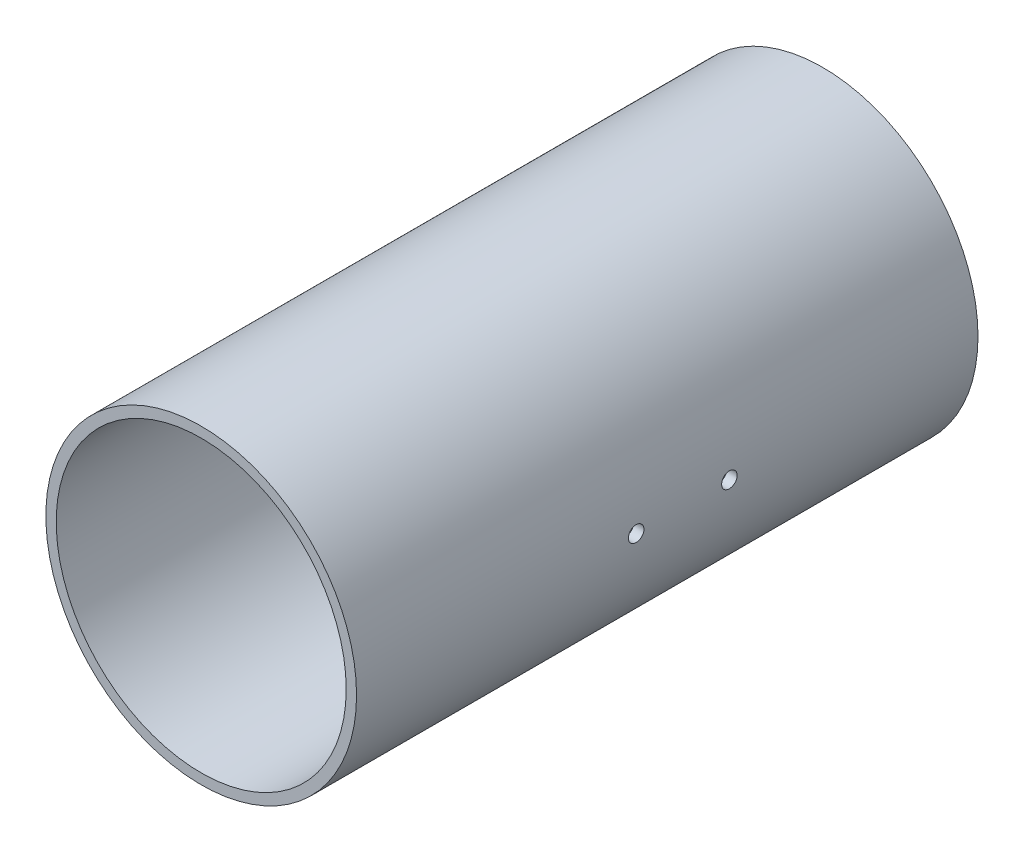
from build123d import *

# Parameters (mm, degrees)
SKETCH1_R               = 30
SKETCH1_R_2             = 28
BOSS_EXTRUDE1_DEPTH     = 120
CUT_EXTRUDE1_DEPTH      = 128.279220614
CUT_EXTRUDE1_DEPTH_BACK = 128.279220614
SKETCH2_R               = 1.5


with BuildPart() as part:
    # Sketch1 → Boss-Extrude1 (new body)
    with BuildSketch(Plane.XY):
        Circle(SKETCH1_R)
        Circle(SKETCH1_R_2, mode=Mode.SUBTRACT)
    extrude(amount=BOSS_EXTRUDE1_DEPTH)

    # Sketch2 → Cut-Extrude1 (cut, two sides: drawn at the far end of the back side and taken through both)
    with BuildSketch(Plane(origin=(0, 0, 0), x_dir=(0, 0, -1), z_dir=(1, 0, 0)).offset(-CUT_EXTRUDE1_DEPTH_BACK)):
        with Locations((-48, 0)):
            Circle(SKETCH2_R)
        with Locations((-66, 0)):
            Circle(SKETCH2_R)
    extrude(amount=CUT_EXTRUDE1_DEPTH + CUT_EXTRUDE1_DEPTH_BACK, mode=Mode.SUBTRACT)


solid = part.part
